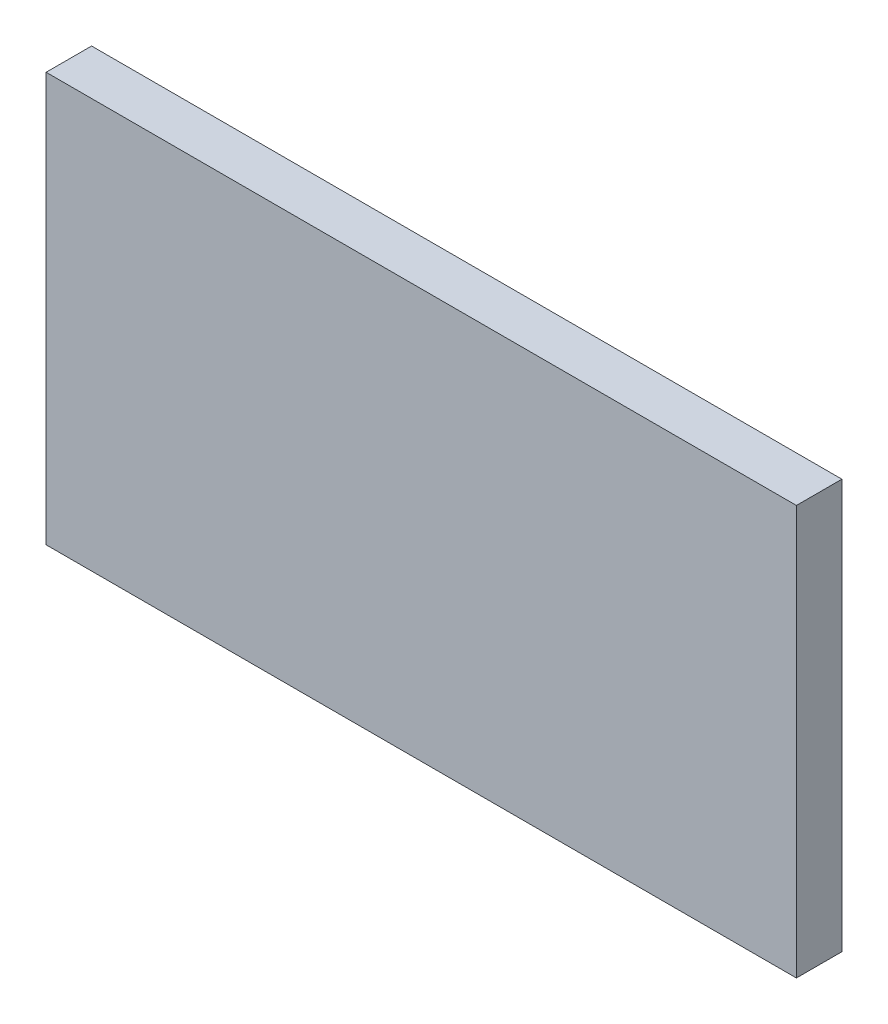
from build123d import *

# Parameters (mm, degrees)
ESQUISSE1_W        = 3300
ESQUISSE1_H        = 1800
BOSS_EXTRU_1_DEPTH = 200


with BuildPart() as part:
    # Esquisse1 → Boss.-Extru.1 (new body)
    with BuildSketch(Plane.XY):
        with Locations((1650, 900)):
            Rectangle(ESQUISSE1_W, ESQUISSE1_H)
    extrude(amount=BOSS_EXTRU_1_DEPTH)


solid = part.part
